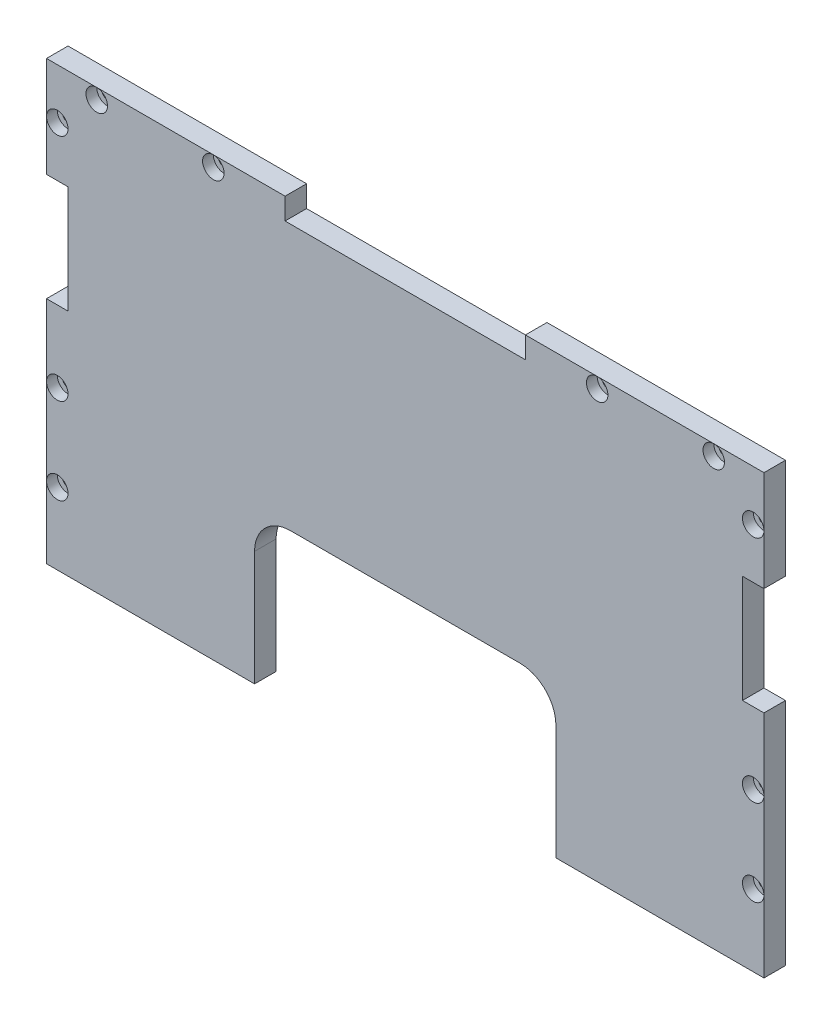
from build123d import *

# Parameters (mm, degrees)
ESQUISSE1_W             = 200
ESQUISSE1_H             = 122
BOSS_EXTRU_1_DEPTH      = 6
ESQUISSE2_W             = 67
ESQUISSE2_H             = 6
ESQUISSE2_W_2           = 6
ESQUISSE2_H_2           = 30
ESQUISSE2_W_3           = 84
ESQUISSE2_H_3           = 42
ENL_V_MAT_EXTRU_1_DEPTH = 6
CONG_1_R                = 10
ESQUISSE3_R             = 1.5
ENL_V_MAT_EXTRU_2_DEPTH = 6
ESQUISSE4_R             = 2.995
ENL_V_MAT_EXTRU_3_DEPTH = 3


with BuildPart() as part:
    # Esquisse1 → Boss.-Extru.1 (new body)
    with BuildSketch(Plane.XY):
        with Locations((3.313253012, -9.644578313)):
            Rectangle(ESQUISSE1_W, ESQUISSE1_H)
    extrude(amount=BOSS_EXTRU_1_DEPTH)

    # Esquisse2 → Enlèv. mat.-Extru.1 (cut)
    with BuildSketch(Plane.XY.offset(6)):
        with Locations((3.313253012, 48.355421687)):
            Rectangle(ESQUISSE2_W, ESQUISSE2_H)
        with Locations((-93.686746988, 8.355421687)):
            Rectangle(ESQUISSE2_W_2, ESQUISSE2_H_2)
        with Locations((100.313253012, 8.355421687)):
            Rectangle(ESQUISSE2_W_2, ESQUISSE2_H_2)
        with Locations((3.313253012, -49.644578313)):
            Rectangle(ESQUISSE2_W_3, ESQUISSE2_H_3)
    extrude(amount=-ENL_V_MAT_EXTRU_1_DEPTH, mode=Mode.SUBTRACT)

    # Congé1
    cong_1_edges = [part.edges().sort_by_distance(p)[0] for p in [
        (-38.686746988, -28.644578313, 3),
        (45.313253012, -28.644578313, 3),
    ]]
    fillet(cong_1_edges, radius=CONG_1_R)

    # Esquisse3 → Enlèv. mat.-Extru.2 (cut)
    with BuildSketch(Plane.XY.offset(6)):
        with Locations((-93.686746988, -50.644578313)):
            Circle(ESQUISSE3_R)
        with Locations((-93.686746988, -26.644578313)):
            Circle(ESQUISSE3_R)
        with Locations((-93.686746988, 37.355421687)):
            Circle(ESQUISSE3_R)
        with Locations((-50.186746988, 48.355421687)):
            Circle(ESQUISSE3_R)
        with Locations((56.813253012, 48.355421687)):
            Circle(ESQUISSE3_R)
        with Locations((100.313253012, 37.355421687)):
            Circle(ESQUISSE3_R)
        with Locations((100.313253012, -26.644578313)):
            Circle(ESQUISSE3_R)
        with Locations((100.313253012, -50.644578313)):
            Circle(ESQUISSE3_R)
        with Locations((-82.686746988, 48.355421687)):
            Circle(ESQUISSE3_R)
        with Locations((89.313253012, 48.355421687)):
            Circle(ESQUISSE3_R)
    extrude(amount=-ENL_V_MAT_EXTRU_2_DEPTH, mode=Mode.SUBTRACT)

    # Esquisse4 → Enlèv. mat.-Extru.3 (cut)
    with BuildSketch(Plane.XY.offset(6)):
        with Locations((-93.686746988, -50.644578313)):
            Circle(ESQUISSE4_R)
        with Locations((-93.686746988, -26.644578313)):
            Circle(ESQUISSE4_R)
        with Locations((-93.686746988, 37.355421687)):
            Circle(ESQUISSE4_R)
        with Locations((-82.686746988, 48.355421687)):
            Circle(ESQUISSE4_R)
        with Locations((-50.186746988, 48.355421687)):
            Circle(ESQUISSE4_R)
        with Locations((56.813253012, 48.355421687)):
            Circle(ESQUISSE4_R)
        with Locations((89.313253012, 48.355421687)):
            Circle(ESQUISSE4_R)
        with Locations((100.313253012, 37.355421687)):
            Circle(ESQUISSE4_R)
        with Locations((100.313253012, -26.644578313)):
            Circle(ESQUISSE4_R)
        with Locations((100.313253012, -50.644578313)):
            Circle(ESQUISSE4_R)
    extrude(amount=-ENL_V_MAT_EXTRU_3_DEPTH, mode=Mode.SUBTRACT)


solid = part.part
